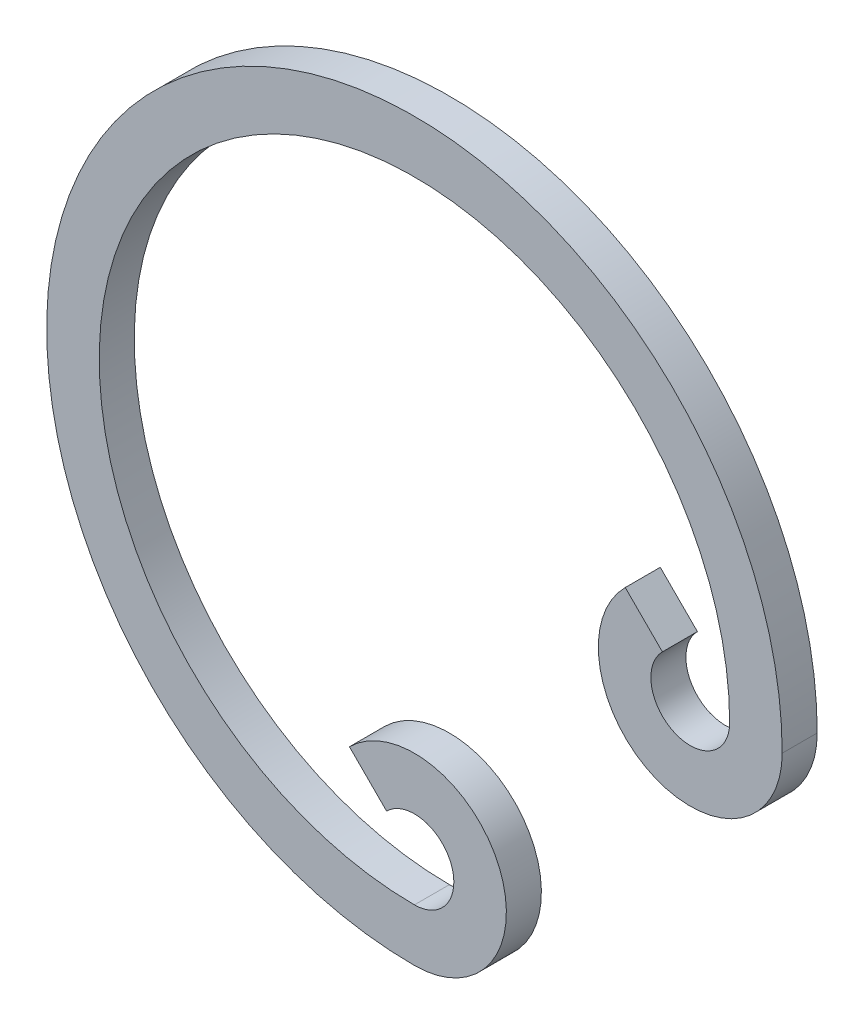
from build123d import *

# Parameters (mm, degrees)
SALIENTE_EXTRUIR1_DEPTH = 1


with BuildPart() as part:
    # Croquis1 → Saliente-Extruir1 (new body)
    with BuildSketch(Plane.XY):
        with BuildLine():
            Line((-0.795495129, -7.079504871), (-1.856155301, -6.018844699))
            ThreePointArc((-1.856155301, -6.018844699), (2.425183773, -6.87045599), (0, -10.5))
            ThreePointArc((0, -10.5), (-9.700735091, -4.01817604), (-7.424621202, 7.424621202))
            Line((-7.424621202, 7.424621202), (-6.363961031, 6.363961031))
            ThreePointArc((-6.363961031, 6.363961031), (-8.314915793, -3.444150891), (0, -9))
            ThreePointArc((0, -9), (1.039364474, -7.444481139), (-0.795495129, -7.079504871))
        make_face()
    saliente_extruir1 = extrude(amount=SALIENTE_EXTRUIR1_DEPTH)

    # Simetría1: Saliente-Extruir1 across plane
    add(saliente_extruir1.mirror(Plane(origin=(-6.363961031, 6.363961031, 1), x_dir=(0, 0, 1), z_dir=(-0.7071067811865474, -0.7071067811865478, 0))))


solid = part.part
